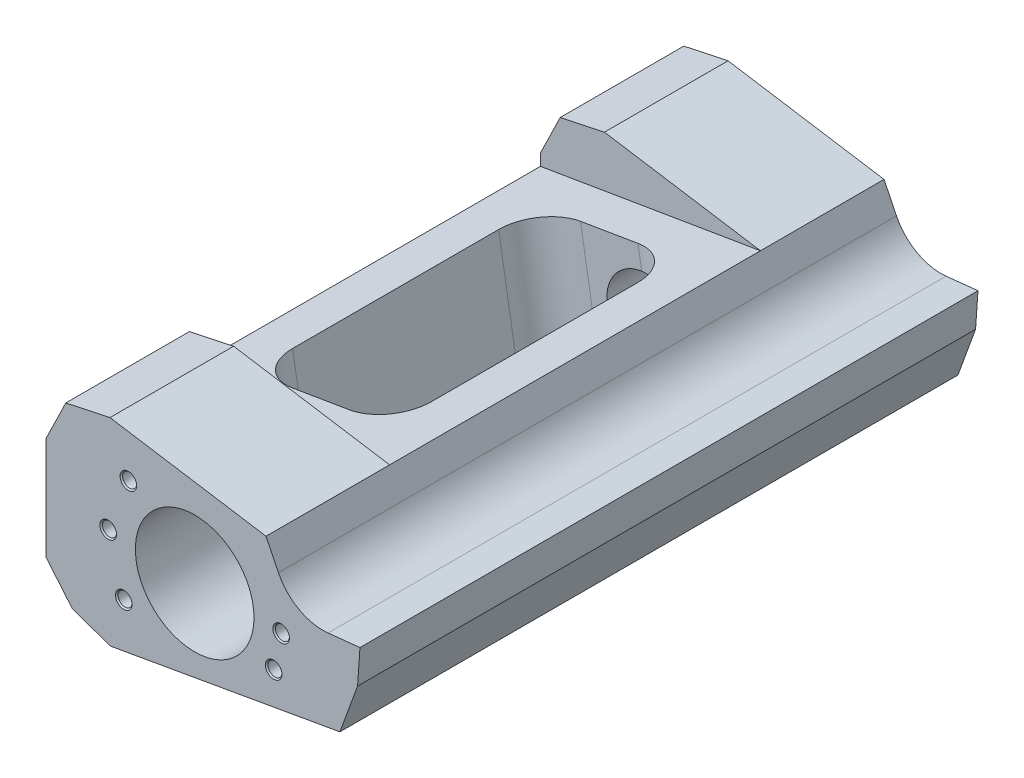
from build123d import *

# Parameters (mm, degrees)
EXTRUS_O_PRINCIPAL_DEPTH    = 250
ESCALA_SCALE                = 1.5
ALIVIO_START                = -75
ALIVIO_SUP_INF_DEPTH        = 225
AL_VIO_CENTRAL_DEPTH        = 344.797069556
AL_VIO_CENTRAL_DEPTH_BACK   = 344.797069556
FUROS_DIR_D                 = 8.5
FUROS_DIR_DEPTH             = 27.5
FUROS_DIR_CSINK_D           = 10.05
FUROS_DIR_CSINK_ANGLE       = 90
FUROS_DIR_TIP               = 2.553657631
FUROS_ESQ_D                 = 8.5
FUROS_ESQ_DEPTH             = 27.5
FUROS_ESQ_CSINK_D           = 10.05
FUROS_ESQ_CSINK_ANGLE       = 90
FUROS_ESQ_TIP               = 2.553657631
ESBO_O7_3_R                 = 25
FURO_EIXO_DEPTH             = 395.584089109
ESBO_O7_R                   = 36
REBAIXO_ROLAMENTO_ESQ_DEPTH = 69
REBAIXO_START               = -306
ESBO_O7_4_R                 = 36
ESBO_O7_4_R_2               = 25
REBAIXO_ROLAMENTO_DIR_DEPTH = 69


with BuildPart() as part:
    # Esboço1 → EXTRUSÃO PRINCIPAL (new body)
    with BuildSketch(Plane.XY):
        with BuildLine():
            Line((65, 0), (64.021024633, -14))
            Line((64.021024633, -14), (56.886629039, -33.601590794))
            Line((56.886629039, -33.601590794), (-36.113370961, -50))
            Line((-36.113370961, -50), (-51.485110725, -44.405144277))
            Line((-51.485110725, -44.405144277), (-62, -31.873987208))
            Line((-62, -31.873987208), (-62, 9.746573698))
            Line((-62, 9.746573698), (-54, 26.190795203))
            Line((-54, 26.190795203), (-36.113370961, 29.996175937))
            Line((-36.113370961, 29.996175937), (27, 20))
            Line((27, 20), (32.013345877, 9.746573698))
            ThreePointArc((32.013345877, 9.746573698), (40.293006212, 1.034435734), (52.07121536, -1.358870022))
            Line((52.07121536, -1.358870022), (65, 0))
        make_face()
    extrude(amount=EXTRUS_O_PRINCIPAL_DEPTH)


with BuildPart() as part_1:
    # ESCALA: scaled about (-7.179170438, -10.680236315, 125)
    add(part.part.scale(ESCALA_SCALE).moved(Location((3.589585219, 5.340118158, -62.5))))

    # Esboço4 → ALIVIO SUP./INF. (cut)
    with BuildSketch(Plane(origin=(0, 0, -62.5), x_dir=(-1, 0, 0), z_dir=(0, 0, -1)).offset(ALIVIO_START)):
        Polygon((89.410414781, 12.959978704), (89.410414781, 19.959978704), (77.410414781, 44.626310962), (50.580471222, 50.334382062), (-44.089585219, 35.340118158), align=None)
        Polygon((73.638080869, -61.267598258), (89.410414781, -42.470862654), (-88.919528778, -45.062268034), (50.580471222, -69.659881842), align=None)
    extrude(amount=-ALIVIO_SUP_INF_DEPTH, mode=Mode.SUBTRACT)

    # Esboço6 → ALÍVIO CENTRAL (cut, two sides: drawn at the far end of the back side and taken through both)
    with BuildSketch(Plane(origin=(-4.557313786, 27.184879328, 0), x_dir=(0.9862375757372075, 0.16533434066761868, 0), z_dir=(-0.16533434066761868, 0.9862375757372075, 0)).offset(-AL_VIO_CENTRAL_DEPTH_BACK)):
        with BuildLine():
            Line((-36.037181185, -37.5), (-0.674259224, -37.5))
            ThreePointArc((-0.674259224, -37.5), (17.003410306, -44.82233047), (24.325740776, -62.5))
            Line((24.325740776, -62.5), (24.325740776, -187.5))
            ThreePointArc((24.325740776, -187.5), (17.003410306, -205.17766953), (-0.674259224, -212.5))
            Line((-0.674259224, -212.5), (-36.037181185, -212.5))
            ThreePointArc((-36.037181185, -212.5), (-53.714850715, -205.17766953), (-61.037181185, -187.5))
            Line((-61.037181185, -187.5), (-61.037181185, -62.5))
            ThreePointArc((-61.037181185, -62.5), (-53.714850715, -44.82233047), (-36.037181185, -37.5))
        make_face()
    extrude(amount=AL_VIO_CENTRAL_DEPTH + AL_VIO_CENTRAL_DEPTH_BACK, mode=Mode.SUBTRACT)

    # FUROS DIR.
    with Locations(Plane.XY.offset(312.5)):
        with Locations((53.280280787, -11.103047714), (-39.437052477, 22.643301795), (-51.681610143, -9.103047714), (-42.225201538, -41.215810622), (48.741417313, -32.456721475)):
            CounterSinkHole(FUROS_DIR_D / 2, FUROS_DIR_CSINK_D / 2, depth=FUROS_DIR_DEPTH, counter_sink_angle=FUROS_DIR_CSINK_ANGLE)
            with Locations((0, 0, -(FUROS_DIR_DEPTH + FUROS_DIR_TIP / 2))):  # 118° drill point
                Cone(0, FUROS_DIR_D / 2, FUROS_DIR_TIP, mode=Mode.SUBTRACT)

    # FUROS ESQ.
    with Locations(Plane(origin=(0, 0, -62.5), x_dir=(-1, 0, 0), z_dir=(0, 0, -1))):
        with Locations((39.437052477, 22.643301795), (51.681610143, -9.103047714), (42.225201538, -41.215810622), (-48.741417313, -32.456721475), (-53.280280787, -11.103047714)):
            CounterSinkHole(FUROS_ESQ_D / 2, FUROS_ESQ_CSINK_D / 2, depth=FUROS_ESQ_DEPTH, counter_sink_angle=FUROS_ESQ_CSINK_ANGLE)
            with Locations((0, 0, -(FUROS_ESQ_DEPTH + FUROS_ESQ_TIP / 2))):  # 118° drill point
                Cone(0, FUROS_ESQ_D / 2, FUROS_ESQ_TIP, mode=Mode.SUBTRACT)

    # Esboço7<3> → FURO EIXO (cut, through all)
    with BuildSketch(Plane.XY.offset(312.5)):
        with Locations((0.809103247, -11.098343232)):
            Circle(ESBO_O7_3_R)
    extrude(amount=-FURO_EIXO_DEPTH, mode=Mode.SUBTRACT)

    # Esboço7 → REBAIXO ROLAMENTO ESQ. (cut)
    with BuildSketch(Plane.XY.offset(312.5)):
        with Locations((0.809103247, -11.098343232)):
            Circle(ESBO_O7_R)
    extrude(amount=-REBAIXO_ROLAMENTO_ESQ_DEPTH, mode=Mode.SUBTRACT)

    # Esboço7<4> → REBAIXO ROLAMENTO DIR. (cut)
    with BuildSketch(Plane.XY.offset(312.5).offset(REBAIXO_START)):
        with Locations((0.809103247, -11.098343232)):
            Circle(ESBO_O7_4_R)
        with Locations(Location((0.809103247, -11.098343232, 0), (0, 0, 280.347956823))):
            Circle(ESBO_O7_4_R_2, mode=Mode.SUBTRACT)
    extrude(amount=-REBAIXO_ROLAMENTO_DIR_DEPTH, mode=Mode.SUBTRACT)


solid = part_1.part
